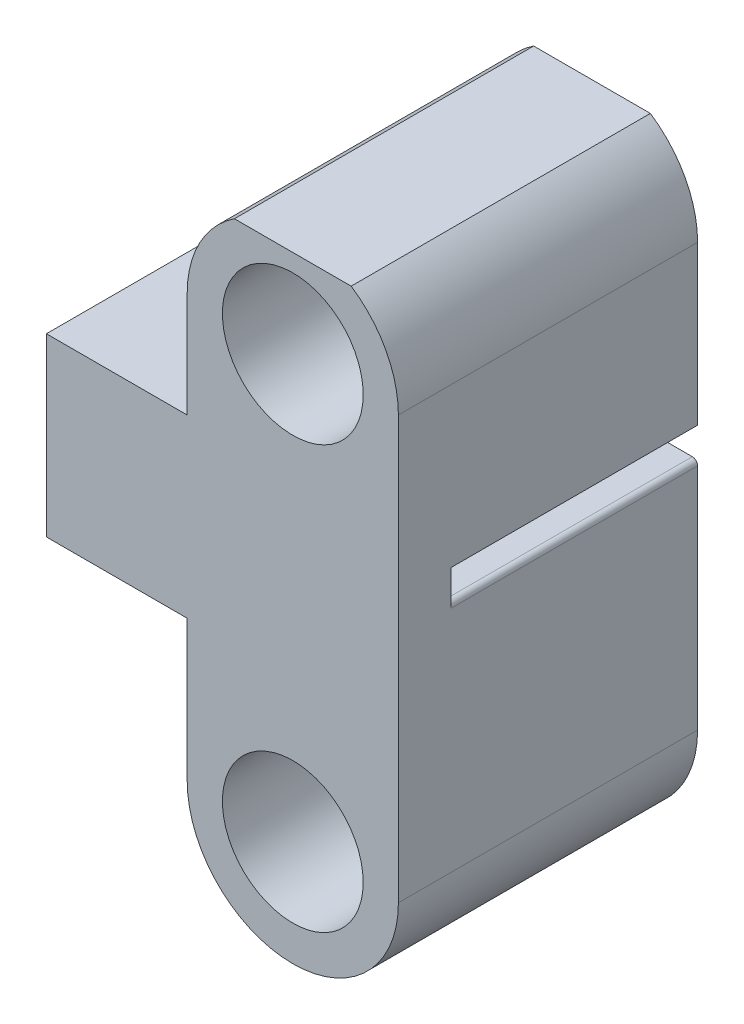
from build123d import *

# Parameters (mm, degrees)
SKETCH1_R           = 2
BOSS_EXTRUDE1_DEPTH = 8.5
SKETCH9_W           = 8.5
SKETCH9_H           = 5
BOSS_EXTRUDE4_DEPTH = 4
SKETCH6_W           = 7
SKETCH6_H           = 1.6
CUT_EXTRUDE5_DEPTH  = 20.931131428
BOSS_EXTRUDE3_DEPTH = 7
SKETCH10_W          = 5
SKETCH10_H          = 1
CUT_EXTRUDE6_DEPTH  = 19.607794066


with BuildPart() as part:
    # Sketch1 → Boss-Extrude1 (new body)
    with BuildSketch(Plane.XY):
        with BuildLine():
            Line((-3, 0), (-3, -12))
            ThreePointArc((-3, -12), (0, -15), (3, -12))
            Line((3, -12), (3, 0))
            ThreePointArc((3, 0), (0, 3), (-3, 0))
        make_face()
        Circle(SKETCH1_R, mode=Mode.SUBTRACT)
        with Locations((0, -12)):
            Circle(SKETCH1_R, mode=Mode.SUBTRACT)
    extrude(amount=BOSS_EXTRUDE1_DEPTH)

    # Sketch9 → Boss-Extrude4 (add)
    with BuildSketch(Plane.ZY.offset(3)):
        with Locations((4.25, -5.5)):
            Rectangle(SKETCH9_W, SKETCH9_H)
    extrude(amount=BOSS_EXTRUDE4_DEPTH)

    # Sketch6 → Cut-Extrude5 (cut, through all)
    with BuildSketch(Plane(origin=(3, 0, 0), x_dir=(0, 0, -1), z_dir=(1, 0, 0))):
        with Locations((-3.5, -5.3)):
            Rectangle(SKETCH6_W, SKETCH6_H)
    extrude(amount=-CUT_EXTRUDE5_DEPTH, mode=Mode.SUBTRACT)

    # Sketch7 → Boss-Extrude3 (add, through all)
    with BuildSketch(Plane(origin=(0, 0, 7), x_dir=(-1, 0, 0), z_dir=(0, 0, -1))):
        with BuildLine():
            Line((-3, -6.1), (-3, -5.5))
            ThreePointArc((-3, -5.5), (-2.956066017, -5.393933983), (-2.85, -5.35))
            Line((-2.85, -5.35), (-2.15, -5.35))
            ThreePointArc((-2.15, -5.35), (-2.043933983, -5.393933983), (-2, -5.5))
            Line((-2, -5.5), (-2, -6.1))
            Line((-2, -6.1), (-3, -6.1))
        make_face()
        with BuildLine():
            Line((-0.85, -5.35), (-0.15, -5.35))
            ThreePointArc((-0.15, -5.35), (-0.043933983, -5.393933983), (0, -5.5))
            Line((0, -5.5), (0, -6.1))
            Line((0, -6.1), (-1, -6.1))
            Line((-1, -6.1), (-1, -5.5))
            ThreePointArc((-1, -5.5), (-0.956066017, -5.393933983), (-0.85, -5.35))
        make_face()
        with BuildLine():
            Line((1.15, -5.35), (1.85, -5.35))
            ThreePointArc((1.85, -5.35), (1.956066017, -5.393933983), (2, -5.5))
            Line((2, -5.5), (2, -6.1))
            Line((2, -6.1), (1, -6.1))
            Line((1, -6.1), (1, -5.5))
            ThreePointArc((1, -5.5), (1.043933983, -5.393933983), (1.15, -5.35))
        make_face()
        with BuildLine():
            Line((3.15, -5.35), (3.85, -5.35))
            ThreePointArc((3.85, -5.35), (3.956066017, -5.393933983), (4, -5.5))
            Line((4, -5.5), (4, -6.1))
            Line((4, -6.1), (3, -6.1))
            Line((3, -6.1), (3, -5.5))
            ThreePointArc((3, -5.5), (3.043933983, -5.393933983), (3.15, -5.35))
        make_face()
        with BuildLine():
            Line((5.15, -5.35), (5.85, -5.35))
            ThreePointArc((5.85, -5.35), (5.956066017, -5.393933983), (6, -5.5))
            Line((6, -5.5), (6, -6.1))
            Line((6, -6.1), (5, -6.1))
            Line((5, -6.1), (5, -5.5))
            ThreePointArc((5, -5.5), (5.043933983, -5.393933983), (5.15, -5.35))
        make_face()
    extrude(amount=BOSS_EXTRUDE3_DEPTH)

    # Sketch10 → Cut-Extrude6 (cut, through all)
    with BuildSketch(Plane.XY.offset(8.5)):
        with Locations((0, 3)):
            Rectangle(SKETCH10_W, SKETCH10_H)
    extrude(amount=-CUT_EXTRUDE6_DEPTH, mode=Mode.SUBTRACT)


solid = part.part
